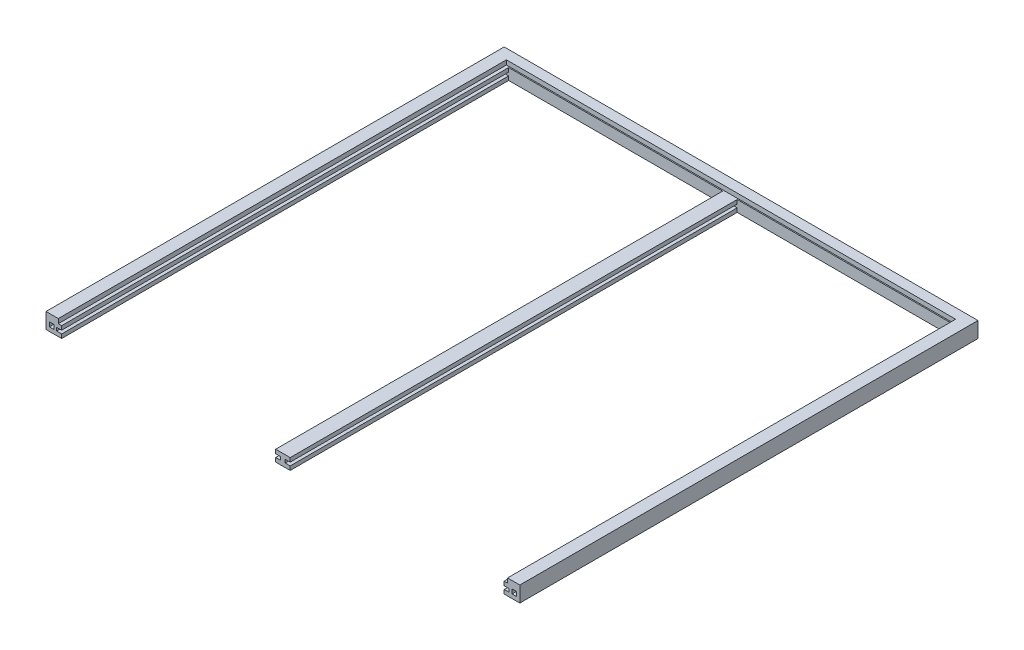
from build123d import *

# Parameters (mm, degrees)
SKETCH1_W           = 2.25
SKETCH1_H           = 1.45
BOSS_EXTRUDE1_DEPTH = 5
BOSS_EXTRUDE2_DEPTH = 200
BOSS_EXTRUDE3_DEPTH = 2
SKETCH4_W           = 2
SKETCH4_H           = 2
CUT_EXTRUDE1_DEPTH  = 3


with BuildPart() as part:
    # Sketch1 → Boss-Extrude1 (new body)
    with BuildSketch(Plane.XY):
        Polygon((0, 0), (7, 0), (7, 1.775), (4.75, 1.775), (4.75, 3.225), (7, 3.225), (7, 5), (0, 5), align=None)
        with Locations((5.875, 2.5)):
            Rectangle(SKETCH1_W, SKETCH1_H)
        Polygon((7, 0), (102.75, 0), (102.75, 1.775), (102.75, 3.225), (102.75, 5), (7, 5), (7, 3.225), (7, 1.775), align=None)
        with Locations((103.875, 2.5)):
            Rectangle(SKETCH1_W, SKETCH1_H)
        Polygon((102.75, 0), (106, 0), (106, 5), (102.75, 5), (102.75, 3.225), (105, 3.225), (105, 1.775), (102.75, 1.775), align=None)
        Polygon((106, 5), (106, 0), (109.25, 0), (109.25, 1.775), (107, 1.775), (107, 3.225), (109.25, 3.225), (109.25, 5), align=None)
        with Locations((108.125, 2.5)):
            Rectangle(SKETCH1_W, SKETCH1_H)
        Polygon((109.25, 1.775), (109.25, 0), (205, 0), (205, 1.775), (205, 3.225), (205, 5), (109.25, 5), (109.25, 3.225), align=None)
        with Locations((206.125, 2.5)):
            Rectangle(SKETCH1_W, SKETCH1_H)
        Polygon((205, 1.775), (205, 0), (212, 0), (212, 5), (205, 5), (205, 3.225), (207.25, 3.225), (207.25, 1.775), align=None)
    extrude(amount=BOSS_EXTRUDE1_DEPTH)

    # Sketch2 → Boss-Extrude2 (add)
    with BuildSketch(Plane.XY.offset(5)):
        Polygon((7, 3.225), (7, 5), (0, 5), (0, 0), (7, 0), (7, 1.775), (4.75, 1.775), (4.75, 3.225), align=None)
        Polygon((109.25, 3.225), (109.25, 5), (102.75, 5), (102.75, 3.225), (105, 3.225), (105, 1.775), (102.75, 1.775), (102.75, 0), (109.25, 0), (109.25, 1.775), (107, 1.775), (107, 3.225), align=None)
        Polygon((205, 5), (205, 3.225), (207.25, 3.225), (207.25, 1.775), (205, 1.775), (205, 0), (212, 0), (212, 5), align=None)
    extrude(amount=BOSS_EXTRUDE2_DEPTH)

    # Sketch3 → Boss-Extrude3 (add)
    with BuildSketch(Plane(origin=(0, 5, 0), x_dir=(1, 0, 0), z_dir=(0, 1, 0))):
        Polygon((5.5, -205), (5.5, -4.5), (206.5, -4.5), (206.5, -205), (212, -205), (212, 0), (0, 0), (0, -205), align=None)
    extrude(amount=BOSS_EXTRUDE3_DEPTH)

    # Sketch4 → Cut-Extrude1 (cut)
    with BuildSketch(Plane.XY.offset(205)):
        with Locations((209.5, 2.76849414)):
            Rectangle(SKETCH4_W, SKETCH4_H)
        with Locations((2.5, 2.76849414)):
            Rectangle(SKETCH4_W, SKETCH4_H)
    extrude(amount=-CUT_EXTRUDE1_DEPTH, mode=Mode.SUBTRACT)


solid = part.part
